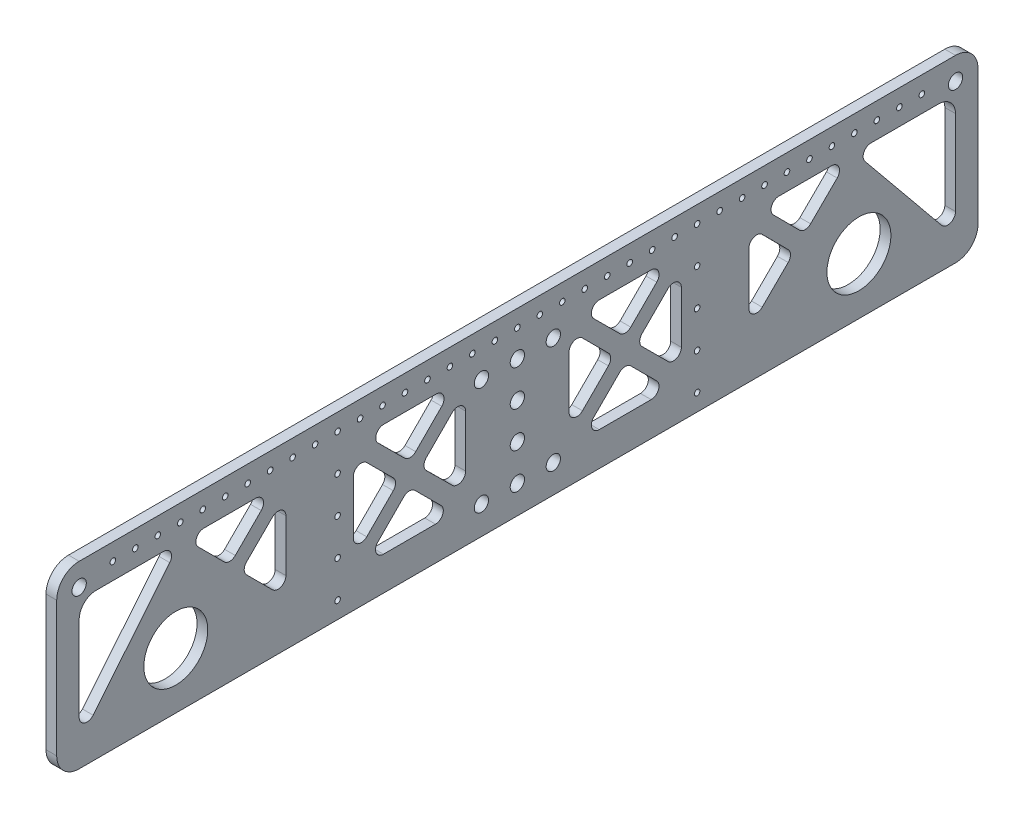
from build123d import *

# Parameters (mm, degrees)
SKETCH2_R           = 14.225
SKETCH2_R_2         = 3.18
SKETCH2_R_3         = 1.25
BOSS_EXTRUDE1_DEPTH = 4.7625


with BuildPart() as part:
    # Sketch2 → Boss-Extrude1 (new body)
    with BuildSketch(Plane(origin=(0, 0, 0), x_dir=(0, 0, -1), z_dir=(1, 0, 0))):
        with BuildLine():
            Line((-23.48132736, 28.668303571), (-23.48132736, -31.331696429))
            ThreePointArc((-23.48132736, -31.331696429), (-20.552395172, -38.40276424), (-13.48132736, -41.331696429))
            Line((-13.48132736, -41.331696429), (376.51867264, -41.331696429))
            ThreePointArc((376.51867264, -41.331696429), (383.589740452, -38.40276424), (386.51867264, -31.331696429))
            Line((386.51867264, -31.331696429), (386.51867264, 28.668303571))
            ThreePointArc((386.51867264, 28.668303571), (383.589740452, 35.739371383), (376.51867264, 38.668303571))
            Line((376.51867264, 38.668303571), (-13.48132736, 38.668303571))
            ThreePointArc((-13.48132736, 38.668303571), (-20.552395172, 35.739371383), (-23.48132736, 28.668303571))
        make_face()
        with Locations(Location((29.51867264, -16.331696429, 0), (0, 0, 180))):
            Circle(SKETCH2_R, mode=Mode.SUBTRACT)
        with Locations(Location((333.51867264, -16.331696429, 0), (0, 0, 180))):
            Circle(SKETCH2_R, mode=Mode.SUBTRACT)
        with Locations(Location((181.51867264, -28.771696429, 0), (0, 0, 180))):
            Circle(SKETCH2_R_2, mode=Mode.SUBTRACT)
        with Locations(Location((197.51867264, -28.771696429, 0), (0, 0, 180))):
            Circle(SKETCH2_R_2, mode=Mode.SUBTRACT)
        with Locations(Location((197.51867264, 19.228303571, 0), (0, 0, 180))):
            Circle(SKETCH2_R_2, mode=Mode.SUBTRACT)
        with Locations(Location((181.51867264, -12.771696429, 0), (0, 0, 180))):
            Circle(SKETCH2_R_2, mode=Mode.SUBTRACT)
        with Locations(Location((181.51867264, 3.228303571, 0), (0, 0, 180))):
            Circle(SKETCH2_R_2, mode=Mode.SUBTRACT)
        with Locations(Location((181.51867264, 19.228303571, 0), (0, 0, 180))):
            Circle(SKETCH2_R_2, mode=Mode.SUBTRACT)
        with Locations(Location((165.51867264, -28.771696429, 0), (0, 0, 180))):
            Circle(SKETCH2_R_2, mode=Mode.SUBTRACT)
        with Locations(Location((165.51867264, 19.228303571, 0), (0, 0, 180))):
            Circle(SKETCH2_R_2, mode=Mode.SUBTRACT)
        with Locations(Location((1.51867264, 31.168303571, 0), (0, 0, 180))):
            Circle(SKETCH2_R_3, mode=Mode.SUBTRACT)
        with Locations(Location((11.51867264, 31.168303571, 0), (0, 0, 180))):
            Circle(SKETCH2_R_3, mode=Mode.SUBTRACT)
        with Locations(Location((21.51867264, 31.168303571, 0), (0, 0, 180))):
            Circle(SKETCH2_R_3, mode=Mode.SUBTRACT)
        with Locations(Location((31.51867264, 31.168303571, 0), (0, 0, 180))):
            Circle(SKETCH2_R_3, mode=Mode.SUBTRACT)
        with Locations(Location((41.51867264, 31.168303571, 0), (0, 0, 180))):
            Circle(SKETCH2_R_3, mode=Mode.SUBTRACT)
        with Locations(Location((51.51867264, 31.168303571, 0), (0, 0, 180))):
            Circle(SKETCH2_R_3, mode=Mode.SUBTRACT)
        with Locations(Location((61.51867264, 31.168303571, 0), (0, 0, 180))):
            Circle(SKETCH2_R_3, mode=Mode.SUBTRACT)
        with Locations(Location((71.51867264, 31.168303571, 0), (0, 0, 180))):
            Circle(SKETCH2_R_3, mode=Mode.SUBTRACT)
        with Locations(Location((81.51867264, 31.168303571, 0), (0, 0, 180))):
            Circle(SKETCH2_R_3, mode=Mode.SUBTRACT)
        with Locations(Location((91.51867264, 31.168303571, 0), (0, 0, 180))):
            Circle(SKETCH2_R_3, mode=Mode.SUBTRACT)
        with Locations(Location((101.51867264, 31.168303571, 0), (0, 0, 180))):
            Circle(SKETCH2_R_3, mode=Mode.SUBTRACT)
        with Locations(Location((111.51867264, 31.168303571, 0), (0, 0, 180))):
            Circle(SKETCH2_R_3, mode=Mode.SUBTRACT)
        with Locations(Location((121.51867264, 31.168303571, 0), (0, 0, 180))):
            Circle(SKETCH2_R_3, mode=Mode.SUBTRACT)
        with Locations(Location((131.51867264, 31.168303571, 0), (0, 0, 180))):
            Circle(SKETCH2_R_3, mode=Mode.SUBTRACT)
        with Locations(Location((141.51867264, 31.168303571, 0), (0, 0, 180))):
            Circle(SKETCH2_R_3, mode=Mode.SUBTRACT)
        with Locations(Location((151.51867264, 31.168303571, 0), (0, 0, 180))):
            Circle(SKETCH2_R_3, mode=Mode.SUBTRACT)
        with Locations(Location((161.51867264, 31.168303571, 0), (0, 0, 180))):
            Circle(SKETCH2_R_3, mode=Mode.SUBTRACT)
        with Locations(Location((171.51867264, 31.168303571, 0), (0, 0, 180))):
            Circle(SKETCH2_R_3, mode=Mode.SUBTRACT)
        with Locations(Location((181.51867264, 31.168303571, 0), (0, 0, 180))):
            Circle(SKETCH2_R_3, mode=Mode.SUBTRACT)
        with Locations(Location((191.51867264, 31.168303571, 0), (0, 0, 180))):
            Circle(SKETCH2_R_3, mode=Mode.SUBTRACT)
        with Locations(Location((201.51867264, 31.168303571, 0), (0, 0, 180))):
            Circle(SKETCH2_R_3, mode=Mode.SUBTRACT)
        with Locations(Location((211.51867264, 31.168303571, 0), (0, 0, 180))):
            Circle(SKETCH2_R_3, mode=Mode.SUBTRACT)
        with Locations(Location((221.51867264, 31.168303571, 0), (0, 0, 180))):
            Circle(SKETCH2_R_3, mode=Mode.SUBTRACT)
        with Locations(Location((231.51867264, 31.168303571, 0), (0, 0, 180))):
            Circle(SKETCH2_R_3, mode=Mode.SUBTRACT)
        with Locations(Location((241.51867264, 31.168303571, 0), (0, 0, 180))):
            Circle(SKETCH2_R_3, mode=Mode.SUBTRACT)
        with Locations(Location((251.51867264, 31.168303571, 0), (0, 0, 180))):
            Circle(SKETCH2_R_3, mode=Mode.SUBTRACT)
        with Locations(Location((261.51867264, 31.168303571, 0), (0, 0, 180))):
            Circle(SKETCH2_R_3, mode=Mode.SUBTRACT)
        with Locations(Location((271.51867264, 31.168303571, 0), (0, 0, 180))):
            Circle(SKETCH2_R_3, mode=Mode.SUBTRACT)
        with Locations(Location((281.51867264, 31.168303571, 0), (0, 0, 180))):
            Circle(SKETCH2_R_3, mode=Mode.SUBTRACT)
        with Locations(Location((291.51867264, 31.168303571, 0), (0, 0, 180))):
            Circle(SKETCH2_R_3, mode=Mode.SUBTRACT)
        with Locations(Location((301.51867264, 31.168303571, 0), (0, 0, 180))):
            Circle(SKETCH2_R_3, mode=Mode.SUBTRACT)
        with Locations(Location((311.51867264, 31.168303571, 0), (0, 0, 180))):
            Circle(SKETCH2_R_3, mode=Mode.SUBTRACT)
        with Locations(Location((321.51867264, 31.168303571, 0), (0, 0, 180))):
            Circle(SKETCH2_R_3, mode=Mode.SUBTRACT)
        with Locations(Location((331.51867264, 31.168303571, 0), (0, 0, 180))):
            Circle(SKETCH2_R_3, mode=Mode.SUBTRACT)
        with Locations(Location((341.51867264, 31.168303571, 0), (0, 0, 180))):
            Circle(SKETCH2_R_3, mode=Mode.SUBTRACT)
        with Locations(Location((351.51867264, 31.168303571, 0), (0, 0, 180))):
            Circle(SKETCH2_R_3, mode=Mode.SUBTRACT)
        with Locations(Location((361.51867264, 31.168303571, 0), (0, 0, 180))):
            Circle(SKETCH2_R_3, mode=Mode.SUBTRACT)
        with Locations(Location((101.51867264, -33.831696429, 0), (0, 0, 180))):
            Circle(SKETCH2_R_3, mode=Mode.SUBTRACT)
        with Locations(Location((261.51867264, -33.831696429, 0), (0, 0, 180))):
            Circle(SKETCH2_R_3, mode=Mode.SUBTRACT)
        with Locations(Location((-13.48132736, 28.668303571, 0), (0, 0, 180))):
            Circle(SKETCH2_R_2, mode=Mode.SUBTRACT)
        with Locations(Location((376.51867264, 28.668303571, 0), (0, 0, 180))):
            Circle(SKETCH2_R_2, mode=Mode.SUBTRACT)
        with Locations(Location((101.51867264, -17.581696429, 0), (0, 0, 180))):
            Circle(SKETCH2_R_3, mode=Mode.SUBTRACT)
        with Locations(Location((261.51867264, -17.581696429, 0), (0, 0, 180))):
            Circle(SKETCH2_R_3, mode=Mode.SUBTRACT)
        with Locations(Location((101.51867264, -1.331696429, 0), (0, 0, 180))):
            Circle(SKETCH2_R_3, mode=Mode.SUBTRACT)
        with Locations(Location((261.51867264, -1.331696429, 0), (0, 0, 180))):
            Circle(SKETCH2_R_3, mode=Mode.SUBTRACT)
        with Locations(Location((101.51867264, 14.918303571, 0), (0, 0, 180))):
            Circle(SKETCH2_R_3, mode=Mode.SUBTRACT)
        with Locations(Location((261.51867264, 14.918303571, 0), (0, 0, 180))):
            Circle(SKETCH2_R_3, mode=Mode.SUBTRACT)
        with BuildLine():
            Line((108.51867264, -13.421543961), (108.51867264, 10.246824665))
            ThreePointArc((108.51867264, 10.246824665), (110.679280626, 13.480403029), (114.493546374, 12.721698399))
            Line((114.493546374, 12.721698399), (126.285683758, 0.929561015))
            ThreePointArc((126.285683758, 0.929561015), (127.310804501, -1.539094988), (126.294461323, -4.011377646))
            Line((126.294461323, -4.011377646), (114.502323939, -15.887608888))
            ThreePointArc((114.502323939, -15.887608888), (110.685027174, -16.657496645), (108.51867264, -13.421543961))
        make_face(mode=Mode.SUBTRACT)
        with BuildLine():
            Line((121.926144032, -26.303427866), (145.068925171, -26.303427866))
            ThreePointArc((145.068925171, -26.303427866), (148.302503535, -24.14281988), (147.543798906, -20.328554132))
            Line((147.543798906, -20.328554132), (135.931295115, -8.716050342))
            ThreePointArc((135.931295115, -8.716050342), (133.45020365, -7.690929599), (130.972770082, -8.724859149))
            Line((130.972770082, -8.724859149), (119.442492733, -20.337362939))
            ThreePointArc((119.442492733, -20.337362939), (118.694950194, -24.148562201), (121.926144032, -26.303427866))
        make_face(mode=Mode.SUBTRACT)
        with BuildLine():
            Line((122.011060377, 23.696572134), (145.398743769, 23.696572134))
            ThreePointArc((145.398743769, 23.696572134), (148.629937607, 21.541706468), (147.882395068, 17.730507206))
            Line((147.882395068, 17.730507206), (136.271648904, 6.036960749))
            ThreePointArc((136.271648904, 6.036960749), (133.800433047, 5.003047768), (131.321932678, 6.019374378))
            Line((131.321932678, 6.019374378), (119.54499545, 17.712920835))
            ThreePointArc((119.54499545, 17.712920835), (118.775107693, 21.530217599), (122.011060377, 23.696572134))
        make_face(mode=Mode.SUBTRACT)
        with BuildLine():
            Line((158.51867264, -12.577318052), (158.51867264, 10.525095141))
            ThreePointArc((158.51867264, 10.525095141), (156.352318105, 13.761047825), (152.535021341, 12.991160068))
            Line((152.535021341, 12.991160068), (140.984106382, 1.357871493))
            ThreePointArc((140.984106382, 1.357871493), (139.967779773, -1.120628877), (141.001692754, -3.591844733))
            Line((141.001692754, -3.591844733), (152.552607712, -15.060969351))
            ThreePointArc((152.552607712, -15.060969351), (156.363806974, -15.808511891), (158.51867264, -12.577318052))
        make_face(mode=Mode.SUBTRACT)
        with BuildLine():
            Line((204.51867264, 10.248556103), (204.51867264, -12.85194896))
            ThreePointArc((204.51867264, -12.85194896), (206.679280626, -16.085527324), (210.493546374, -15.326822694))
            Line((210.493546374, -15.326822694), (222.043798906, -3.776570163))
            ThreePointArc((222.043798906, -3.776570163), (223.068925171, -1.301696429), (222.043798906, 1.173177306))
            Line((222.043798906, 1.173177306), (210.493546374, 12.723429837))
            ThreePointArc((210.493546374, 12.723429837), (206.679280626, 13.482134467), (204.51867264, 10.248556103))
        make_face(mode=Mode.SUBTRACT)
        with BuildLine():
            Line((217.968420108, 23.698303571), (241.068925171, 23.698303571))
            ThreePointArc((241.068925171, 23.698303571), (244.302503535, 21.537695585), (243.543798906, 17.723429837))
            Line((243.543798906, 17.723429837), (231.993546374, 6.173177306))
            ThreePointArc((231.993546374, 6.173177306), (229.51867264, 5.14805104), (227.043798906, 6.173177306))
            Line((227.043798906, 6.173177306), (215.493546374, 17.723429837))
            ThreePointArc((215.493546374, 17.723429837), (214.734841744, 21.537695585), (217.968420108, 23.698303571))
        make_face(mode=Mode.SUBTRACT)
        with BuildLine():
            Line((217.968420108, -26.301696429), (241.068925171, -26.301696429))
            ThreePointArc((241.068925171, -26.301696429), (244.302503535, -24.141088442), (243.543798906, -20.326822694))
            Line((243.543798906, -20.326822694), (231.993546374, -8.776570163))
            ThreePointArc((231.993546374, -8.776570163), (229.51867264, -7.751443897), (227.043798906, -8.776570163))
            Line((227.043798906, -8.776570163), (215.493546374, -20.326822694))
            ThreePointArc((215.493546374, -20.326822694), (214.734841744, -24.141088442), (217.968420108, -26.301696429))
        make_face(mode=Mode.SUBTRACT)
        with BuildLine():
            Line((254.51867264, 10.248556103), (254.51867264, -12.85194896))
            ThreePointArc((254.51867264, -12.85194896), (252.358064653, -16.085527324), (248.543798906, -15.326822694))
            Line((248.543798906, -15.326822694), (236.993546374, -3.776570163))
            ThreePointArc((236.993546374, -3.776570163), (235.968420108, -1.301696429), (236.993546374, 1.173177306))
            Line((236.993546374, 1.173177306), (248.543798906, 12.723429837))
            ThreePointArc((248.543798906, 12.723429837), (252.358064653, 13.482134467), (254.51867264, 10.248556103))
        make_face(mode=Mode.SUBTRACT)
        with BuildLine():
            Line((78.51867264, 10.246824665), (78.51867264, -12.853680398))
            ThreePointArc((78.51867264, -12.853680398), (76.358064653, -16.087258762), (72.543798906, -15.328554132))
            Line((72.543798906, -15.328554132), (60.993546374, -3.778301601))
            ThreePointArc((60.993546374, -3.778301601), (59.968420108, -1.303427866), (60.993546374, 1.171445868))
            Line((60.993546374, 1.171445868), (72.543798906, 12.721698399))
            ThreePointArc((72.543798906, 12.721698399), (76.358064653, 13.480403029), (78.51867264, 10.246824665))
        make_face(mode=Mode.SUBTRACT)
        with BuildLine():
            Line((65.068925171, 23.696572134), (41.968420108, 23.696572134))
            ThreePointArc((41.968420108, 23.696572134), (38.734841744, 21.535964147), (39.493546374, 17.721698399))
            Line((39.493546374, 17.721698399), (51.043798906, 6.171445868))
            ThreePointArc((51.043798906, 6.171445868), (53.51867264, 5.146319602), (55.993546374, 6.171445868))
            Line((55.993546374, 6.171445868), (67.543798906, 17.721698399))
            ThreePointArc((67.543798906, 17.721698399), (68.302503535, 21.535964147), (65.068925171, 23.696572134))
        make_face(mode=Mode.SUBTRACT)
        with BuildLine():
            Line((284.51867264, 10.200494298), (284.51867264, -12.899548576))
            ThreePointArc((284.51867264, -12.899548576), (286.672812024, -16.130439971), (290.483620756, -15.384308279))
            Line((290.483620756, -15.384308279), (302.033272122, -3.926745064))
            ThreePointArc((302.033272122, -3.926745064), (303.068295969, -1.455994269), (302.053083709, 1.022962755))
            Line((302.053083709, 1.022962755), (290.503432343, 12.665442414))
            ThreePointArc((290.503432343, 12.665442414), (286.685754593, 13.43674668), (284.51867264, 10.200494298))
        make_face(mode=Mode.SUBTRACT)
        with BuildLine():
            Line((297.920820492, 23.698303571), (321.382542956, 23.698303571))
            ThreePointArc((321.382542956, 23.698303571), (324.618795338, 21.531221618), (323.847491072, 17.713543868))
            Line((323.847491072, 17.713543868), (312.022723992, 5.983058501))
            ThreePointArc((312.022723992, 5.983058501), (309.543766968, 4.967846241), (307.073016172, 6.002870089))
            Line((307.073016172, 6.002870089), (295.436060789, 17.733355455))
            ThreePointArc((295.436060789, 17.733355455), (294.689929098, 21.544164187), (297.920820492, 23.698303571))
        make_face(mode=Mode.SUBTRACT)
        with BuildLine():
            Line((376.51867264, -21.522629618), (376.51867264, 16.198303571))
            ThreePointArc((376.51867264, 16.198303571), (374.321973499, 21.50160443), (369.01867264, 23.698303571))
            Line((369.01867264, 23.698303571), (338.901972775, 23.698303571))
            ThreePointArc((338.901972775, 23.698303571), (335.739329185, 21.697531879), (336.192530033, 17.982695296))
            Line((336.192530033, 17.982695296), (370.309229898, -23.738237893))
            ThreePointArc((370.309229898, -23.738237893), (374.194884866, -24.819070851), (376.51867264, -21.522629618))
        make_face(mode=Mode.SUBTRACT)
        with BuildLine():
            Line((-7.271918781, -23.738518586), (26.844634022, 17.980922082))
            ThreePointArc((26.844634022, 17.980922082), (27.297880592, 21.695776059), (24.135225443, 23.696572134))
            Line((24.135225443, 23.696572134), (-5.98132736, 23.696572134))
            ThreePointArc((-5.98132736, 23.696572134), (-11.284628219, 21.499872993), (-13.48132736, 16.196572134))
            Line((-13.48132736, 16.196572134), (-13.48132736, -21.522868535))
            ThreePointArc((-13.48132736, -21.522868535), (-11.157565001, -24.819300699), (-7.271918781, -23.738518586))
        make_face(mode=Mode.SUBTRACT)
    extrude(amount=BOSS_EXTRUDE1_DEPTH)


solid = part.part
